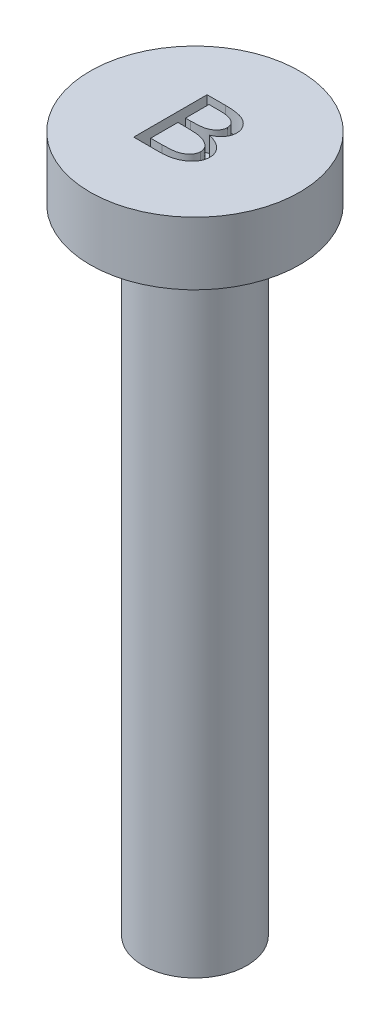
from build123d import *

# Parameters (mm, degrees)
SKETCH1_R                    = 2.475
BOSS_EXTRUDE1_DEPTH          = 30.2
SKETCH2_R                    = 5
BOSS_EXTRUDE2_DEPTH          = 3
M2_5X0_45_TAPPED_HOLE2_D     = 2.05
M2_5X0_45_TAPPED_HOLE2_DEPTH = 7.25
M2_5X0_45_TAPPED_HOLE2_TIP   = 0.615882135
CUT_EXTRUDE1_DEPTH           = 1


with BuildPart() as part:
    # Sketch1 → Boss-Extrude1 (new body)
    with BuildSketch(Plane(origin=(0, 0, 0), x_dir=(1, 0, 0), z_dir=(0, 1, 0))):
        with Locations(Location((0, 0, 0), (0, 0, 270))):
            Circle(SKETCH1_R)
    extrude(amount=BOSS_EXTRUDE1_DEPTH)

    # Sketch2 → Boss-Extrude2 (add)
    with BuildSketch(Plane(origin=(0, 30.2, 0), x_dir=(1, 0, 0), z_dir=(0, 1, 0))):
        with Locations(Location((0, 0, 0), (0, 0, 270))):
            Circle(SKETCH2_R)
    extrude(amount=BOSS_EXTRUDE2_DEPTH)

    # M2.5x0.45 Tapped Hole2
    with Locations(Plane(origin=(0, 0, 0), x_dir=(-1, 0, 0), z_dir=(0, -1, 0))):
        with Locations((0, 0)):
            Hole(M2_5X0_45_TAPPED_HOLE2_D / 2, depth=M2_5X0_45_TAPPED_HOLE2_DEPTH)
            with Locations((0, 0, -(M2_5X0_45_TAPPED_HOLE2_DEPTH + M2_5X0_45_TAPPED_HOLE2_TIP / 2))):  # 118° drill point
                Cone(0, M2_5X0_45_TAPPED_HOLE2_D / 2, M2_5X0_45_TAPPED_HOLE2_TIP, mode=Mode.SUBTRACT)

    # Sketch15 → Cut-Extrude1 (cut)
    with BuildSketch(Plane(origin=(0, 33.2, 0), x_dir=(1, 0, 0), z_dir=(0, 1, 0))):
        with BuildLine():
            Line((-1.233974359, 1.812951114), (-0.36318109, 1.812951114))
            add(Edge.make_bspline(
                [(-0.36318109, 1.812951114), (-0.320639792, 1.81277482), (-0.238097313, 1.812432758), (-0.117944897, 1.807143974), (-0.005417149, 1.799981229), (0.099544539, 1.788516219), (0.196648731, 1.774795951), (0.286334292, 1.758075463), (0.368386787, 1.738061375), (0.466181104, 1.706551189), (0.577385314, 1.659544464), (0.69854813, 1.590428983), (0.803039094, 1.505102662), (0.877878706, 1.423867273), (0.929466312, 1.354120247), (0.962333975, 1.29956986), (0.991258246, 1.244562421), (1.014994605, 1.187686093), (1.03202411, 1.128998157), (1.044819465, 1.069026747), (1.052748306, 1.007805904), (1.053904509, 0.96648646), (1.054487179, 0.945663454)],
                knots=[0, 0, 0, 0, 1.369395837, 2.657025819, 3.871165245, 4.998641136, 6.055205263, 7.027626947, 7.93453697, 8.772070297, 10.33297941, 11.813084282, 13.246620381, 14.657649904, 15.357394331, 16.036113692, 16.705765142, 17.356858567, 18.01624541, 18.669941831, 19.32971487, 20, 20, 20, 20], degree=3))
            add(Edge.make_bspline(
                [(1.054487179, 0.945663454), (1.052654691, 0.906966077), (1.049036329, 0.83055573), (1.022472193, 0.718394704), (0.976599056, 0.612617091), (0.914657599, 0.512329552), (0.835047458, 0.419836309), (0.738822803, 0.335989818), (0.625254813, 0.261839362), (0.541323489, 0.221824121), (0.497796474, 0.201072108)],
                knots=[0, 0, 0, 0, 0.940699359, 1.857468692, 2.784365282, 3.733848908, 4.713424377, 5.740520916, 6.828227955, 8, 8, 8, 8], degree=3))
            add(Edge.make_bspline(
                [(0.497796474, 0.201072108), (0.551768458, 0.185885857), (0.654151048, 0.157078178), (0.796065663, 0.105389985), (0.918408451, 0.049772841), (1.022231895, -0.011295733), (1.110522963, -0.078039162), (1.189022557, -0.14879913), (1.255397333, -0.227838547), (1.312111012, -0.312229672), (1.356926733, -0.401765633), (1.389714175, -0.495676987), (1.410030166, -0.593359641), (1.412313767, -0.660043172), (1.413461538, -0.693559303)],
                knots=[0, 0, 0, 0, 1.455388961, 2.760811819, 3.917406684, 4.940403342, 5.880962759, 6.78714742, 7.678335857, 8.55349333, 9.421892728, 10.270128957, 11.13054119, 12, 12, 12, 12], degree=3))
            add(Edge.make_bspline(
                [(1.413461538, -0.693559303), (1.412242032, -0.727766419), (1.409835393, -0.795272532), (1.390894564, -0.894196499), (1.36088474, -0.989122853), (1.317295116, -1.079552584), (1.262055501, -1.166202634), (1.195329189, -1.249512571), (1.114856404, -1.327158434), (1.024464106, -1.401484855), (0.922871793, -1.468011987), (0.813113979, -1.527831578), (0.693968983, -1.576136638), (0.567314142, -1.617190861), (0.43218615, -1.648584594), (0.288953701, -1.670407593), (0.137495898, -1.685226372), (0.033691266, -1.686430398), (-0.01963141, -1.687048886)],
                knots=[0, 0, 0, 0, 0.84636283, 1.670256716, 2.484525081, 3.304937408, 4.147653302, 5.024173689, 5.940669469, 6.911204725, 7.917390592, 8.942545822, 10.000945251, 11.095161556, 12.236182265, 13.430964445, 14.680330095, 16, 16, 16, 16], degree=3))
            Line((-0.01963141, -1.687048886), (-1.233974359, -1.687048886))
            Line((-1.233974359, -1.687048886), (-1.233974359, 1.812951114))
        make_face()
        with BuildLine():
            Line((-0.78525641, 1.453976755), (-0.78525641, 0.332181883))
            Line((-0.78525641, 0.332181883), (-0.534254808, 0.332181883))
            add(Edge.make_bspline(
                [(-0.534254808, 0.332181883), (-0.497329505, 0.332581376), (-0.426039685, 0.333352655), (-0.322906469, 0.335567073), (-0.227348255, 0.341740614), (-0.139336138, 0.348009662), (-0.058900721, 0.357993139), (0.013762316, 0.370008339), (0.079332379, 0.382624131), (0.154899034, 0.404259896), (0.240417473, 0.435647338), (0.332105819, 0.484931753), (0.412678402, 0.543856716), (0.481314845, 0.611394969), (0.536663448, 0.686573824), (0.57599864, 0.767139114), (0.601758026, 0.851788302), (0.604422567, 0.909955529), (0.605769231, 0.939353358)],
                knots=[0, 0, 0, 0, 1.228781612, 2.372346689, 3.431775579, 4.414692591, 5.307870858, 6.127357932, 6.865508947, 7.527788984, 8.741043829, 9.889226724, 10.97954299, 12.051822853, 13.081523397, 14.06922767, 15.024183967, 16, 16, 16, 16], degree=3))
            add(Edge.make_bspline(
                [(0.605769231, 0.939353358), (0.605069578, 0.958793616), (0.603694839, 0.996991554), (0.593661455, 1.052580133), (0.577534344, 1.105242414), (0.554328035, 1.154703777), (0.5237272, 1.200237525), (0.487498602, 1.243054995), (0.444430933, 1.282429509), (0.394180863, 1.318194021), (0.336986398, 1.350636833), (0.272169726, 1.378747532), (0.199333131, 1.401261658), (0.119403459, 1.421298849), (0.031136116, 1.435282122), (-0.064476809, 1.446778275), (-0.168191884, 1.452820409), (-0.239777112, 1.453581571), (-0.276943109, 1.453976755)],
                knots=[0, 0, 0, 0, 0.81361945, 1.598671385, 2.356922644, 3.11416307, 3.876758201, 4.647284559, 5.457543271, 6.312925357, 7.224393372, 8.206010094, 9.264318981, 10.412951858, 11.653205513, 13.002848701, 14.443923124, 16, 16, 16, 16], degree=3))
            Line((-0.276943109, 1.453976755), (-0.78525641, 1.453976755))
        make_face(mode=Mode.SUBTRACT)
        with BuildLine():
            Line((-0.78525641, -0.026792476), (-0.78525641, -1.328074527))
            Line((-0.78525641, -1.328074527), (-0.239783654, -1.328074527))
            add(Edge.make_bspline(
                [(-0.239783654, -1.328074527), (-0.200987304, -1.327690356), (-0.125956017, -1.326947378), (-0.017469258, -1.324522225), (0.083100767, -1.3191041), (0.17537521, -1.31032603), (0.259927106, -1.301113071), (0.336165219, -1.288439684), (0.40454898, -1.273893981), (0.483978905, -1.251863739), (0.573325451, -1.217636717), (0.669712619, -1.165152633), (0.75566181, -1.103329109), (0.828970911, -1.03131561), (0.888686141, -0.952756222), (0.932418672, -0.869523141), (0.96005753, -0.782699587), (0.963185334, -0.723201137), (0.96474359, -0.693559303)],
                knots=[0, 0, 0, 0, 1.229962997, 2.378721407, 3.439847587, 4.421852365, 5.31694785, 6.13545284, 6.87076298, 7.532272478, 8.747192924, 9.894301625, 11.002789606, 12.092524487, 13.140140875, 14.117719788, 15.062257293, 16, 16, 16, 16], degree=3))
            add(Edge.make_bspline(
                [(0.96474359, -0.693559303), (0.964248878, -0.675063946), (0.963265781, -0.638309743), (0.954024974, -0.584078298), (0.937930082, -0.532037628), (0.91842641, -0.48095885), (0.889767871, -0.433133136), (0.857272369, -0.385843714), (0.817562099, -0.341127783), (0.772510175, -0.298244001), (0.722331889, -0.257897223), (0.667454581, -0.22063784), (0.608022441, -0.186922123), (0.544201506, -0.155945118), (0.47544777, -0.128829439), (0.402387834, -0.105003984), (0.324849413, -0.084628111), (0.271392504, -0.073739953), (0.243990385, -0.068158662)],
                knots=[0, 0, 0, 0, 0.855972342, 1.700998913, 2.536409134, 3.376362511, 4.224639329, 5.110263021, 6.030513101, 6.987259223, 7.987740375, 9.008211689, 10.055134299, 11.148935388, 12.290305944, 13.47432859, 14.705335734, 16, 16, 16, 16], degree=3))
            add(Edge.make_bspline(
                [(0.243990385, -0.068158662), (0.223684811, -0.064699565), (0.179484109, -0.057169883), (0.107606648, -0.049320661), (0.025555986, -0.042263275), (-0.066812959, -0.037035463), (-0.169619858, -0.031670757), (-0.283016111, -0.029566976), (-0.406639983, -0.027064663), (-0.492419411, -0.02688564), (-0.537059295, -0.026792476)],
                knots=[0, 0, 0, 0, 0.631265822, 1.374124787, 2.215341576, 3.155543556, 4.209810819, 5.370695037, 6.631701453, 8, 8, 8, 8], degree=3))
            Line((-0.537059295, -0.026792476), (-0.78525641, -0.026792476))
        make_face(mode=Mode.SUBTRACT)
    extrude(amount=-CUT_EXTRUDE1_DEPTH, mode=Mode.SUBTRACT)


solid = part.part
